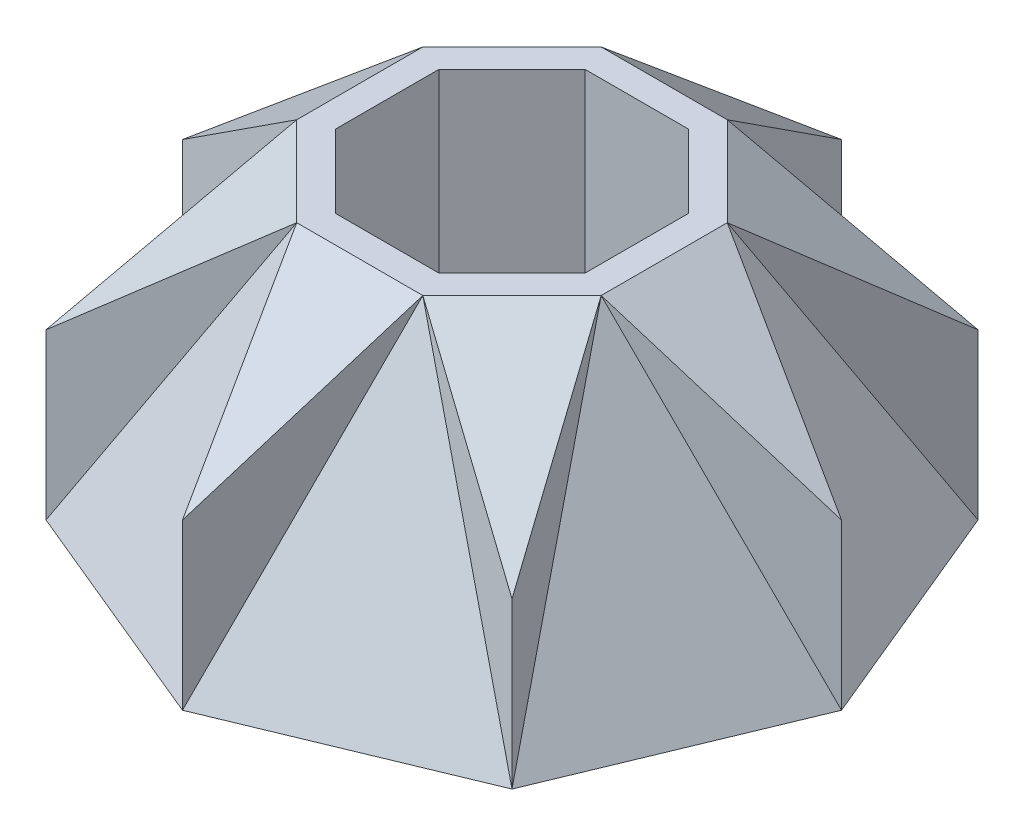
from build123d import *

# Parameters (mm, degrees)
EXTRUDE_1_DEPTH          = 55
SKETCH_2_W               = 237.150162915
SKETCH_2_H               = 226.505018445
CUT_EXTRUDE_2_DEPTH      = 50
PATTERN_CIRCULAR_1_COUNT = 8
CUT_EXTRUDE_4_DEPTH      = 50
PATTERN_CIRCULAR_2_COUNT = 8
PATTERN_CIRCULAR_3_COUNT = 8


with BuildPart() as part:
    # 草图1 → 凸台-拉伸1 (new body)
    with BuildSketch(Plane(origin=(0, 0, 0), x_dir=(1, 0, 0), z_dir=(0, 1, 0))):
        Polygon((42.426406871, -42.426406871), (60, 0), (42.426406871, 42.426406871), (0, 60), (-42.426406871, 42.426406871), (-60, 0), (-42.426406871, -42.426406871), (0, -60), align=None)
        Polygon((9.409435159, -22.716385975), (-9.409435159, -22.716385975), (-22.716385975, -9.409435159), (-22.716385975, 9.409435159), (-9.409435159, 22.716385975), (9.409435159, 22.716385975), (22.716385975, 9.409435159), (22.716385975, -9.409435159), align=None, mode=Mode.SUBTRACT)
    extrude(amount=-EXTRUDE_1_DEPTH)

    # 草图2 → 切除-拉伸2 (cut)
    with BuildSketch(Plane(origin=(9.458106821, 11.428666551, 22.833889762), x_dir=(0.9377373338355196, -0.15546504638213055, -0.31061119117709407), z_dir=(0.3473452068635053, 0.4197132282763384, 0.8385655092351479))):
        with Locations((8.121798023, -48.808385087)):
            Rectangle(SKETCH_2_W, SKETCH_2_H)
    cut_extrude_2 = extrude(amount=CUT_EXTRUDE_2_DEPTH, mode=Mode.SUBTRACT)

    # 阵列(圆周)1: 切除-拉伸2 ×8 about axis
    pattern_circular_1_axis = Axis((0, 57.75, 0), (0, -1, 0))
    for i in range(1, PATTERN_CIRCULAR_1_COUNT):
        add(cut_extrude_2.rotate(pattern_circular_1_axis, i * 360 / PATTERN_CIRCULAR_1_COUNT), mode=Mode.SUBTRACT)

    # 草图4 → 切除-拉伸4 (cut)
    with BuildSketch(Plane(origin=(-10.390122067, 13.417227619, 0), x_dir=(-0.790649794264111, -0.6122686524966953, 0), z_dir=(0.6122686524966953, -0.790649794264111, 0))):
        Polygon((62.745703968, 0), (21.913954869, -11.480502971), (21.913954869, 11.480502971), align=None)
    cut_extrude_4 = extrude(amount=-CUT_EXTRUDE_4_DEPTH, mode=Mode.SUBTRACT)

    # 草图6 → 放样1 section 0
    with BuildSketch(Plane.XZ.offset(55)):
        with BuildLine():
            Line((-60, 0), (-27.716385975, 11.480502971))
            Line((-27.716385975, 11.480502971), (-27.716385975, -11.480502971))
            Line((-27.716385975, -11.480502971), (-60, 0))
        make_face()
    # 草图5 → 放样1 section 1
    with BuildSketch(Plane(origin=(-10.390122067, 13.417227619, 0), x_dir=(-0.790649794264111, -0.6122686524966953, 0), z_dir=(0.6122686524966953, -0.790649794264111, 0))):
        with BuildLine():
            Line((62.745703968, 0), (21.913954869, -11.480502971))
            Line((21.913954869, -11.480502971), (21.913954869, 11.480502971))
            Line((21.913954869, 11.480502971), (62.745703968, 0))
        make_face()
    loft_1 = loft()

    # 阵列(圆周)2: 放样1 ×8 about axis
    pattern_circular_2_axis = Axis((0, 57.75, 0), (0, -1, 0))
    for i in range(1, PATTERN_CIRCULAR_2_COUNT):
        add(loft_1.rotate(pattern_circular_2_axis, i * 360 / PATTERN_CIRCULAR_2_COUNT))

    # 阵列(圆周)3: 切除-拉伸4 ×8 about axis
    pattern_circular_3_axis = Axis((0, 57.75, 0), (0, -1, 0))
    for i in range(1, PATTERN_CIRCULAR_3_COUNT):
        add(cut_extrude_4.rotate(pattern_circular_3_axis, i * 360 / PATTERN_CIRCULAR_3_COUNT), mode=Mode.SUBTRACT)


solid = part.part
